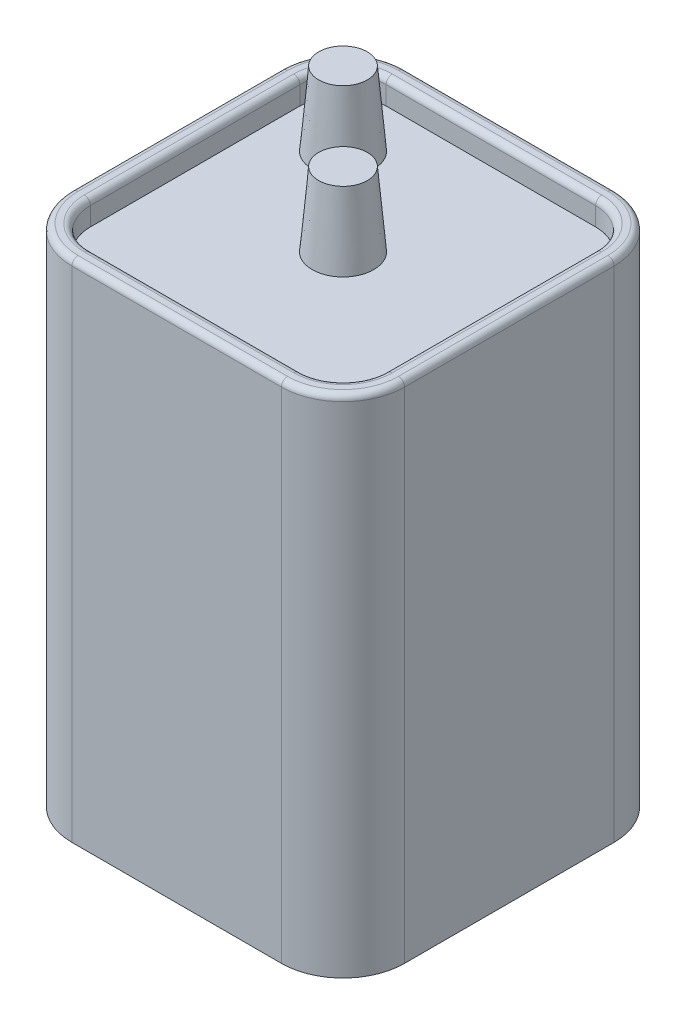
from build123d import *

# Parameters (mm, degrees)
SKETCH1_W                = 68.58
SKETCH1_H                = 68.58
BASE_EXTRUDE_DEPTH       = 104.14
SIDE_FILLET_R            = 12.7
TOP_CUT_DEPTH            = 5.08
FILLET_2_R               = 1.27
SKETCH_TERMINALS_R       = 6.35
TERMIALS_DEPTH           = 15.24
TERMIALS_DRAFT           = 5
TERMIALS_PROFILE_2_DEPTH = 15.24
TERMIALS_PROFILE_2_DRAFT = 5


with BuildPart() as part:
    # Sketch1 → Base Extrude (new body)
    with BuildSketch(Plane(origin=(0, 0, 0), x_dir=(1, 0, 0), z_dir=(0, 1, 0))):
        Rectangle(SKETCH1_W, SKETCH1_H)
    extrude(amount=BASE_EXTRUDE_DEPTH)

    # Side Fillet
    side_fillet_edges = [part.edges().sort_by_distance(p)[0] for p in [
        (34.29, 52.07, 34.29),
        (-34.29, 52.07, 34.29),
        (-34.29, 52.07, -34.29),
        (34.29, 52.07, -34.29),
    ]]
    fillet(side_fillet_edges, radius=SIDE_FILLET_R)

    # Sketch2 → Top Cut (cut)
    with BuildSketch(Plane(origin=(0, 104.14, 0), x_dir=(1, 0, 0), z_dir=(0, 1, 0))):
        with BuildLine():
            Line((-30.48, 21.59), (-30.48, -21.59))
            ThreePointArc((-30.48, -21.59), (-27.876179285, -27.876179285), (-21.59, -30.48))
            Line((-21.59, -30.48), (21.59, -30.48))
            ThreePointArc((21.59, -30.48), (27.876179285, -27.876179285), (30.48, -21.59))
            Line((30.48, -21.59), (30.48, 21.59))
            ThreePointArc((30.48, 21.59), (27.876179285, 27.876179285), (21.59, 30.48))
            Line((21.59, 30.48), (-21.59, 30.48))
            ThreePointArc((-21.59, 30.48), (-27.876179285, 27.876179285), (-30.48, 21.59))
        make_face()
    extrude(amount=-TOP_CUT_DEPTH, mode=Mode.SUBTRACT)

    # Fillet 2
    fillet_2_edges = [part.edges().sort_by_distance(p)[0] for p in [
        (0, 104.14, 34.29),
        (-34.29, 104.14, 0),
        (34.29, 104.14, 0),
        (0, 104.14, -34.29),
        (-30.570256121, 104.14, -30.570256121),
        (30.570256121, 104.14, -30.570256121),
        (30.570256121, 104.14, 30.570256121),
        (-30.570256121, 104.14, 30.570256121),
        (-27.876179285, 104.14, -27.876179285),
        (-30.48, 104.14, 0),
        (-27.876179285, 104.14, 27.876179285),
        (0, 104.14, 30.48),
        (27.876179285, 104.14, 27.876179285),
        (30.48, 104.14, 0),
        (27.876179285, 104.14, -27.876179285),
        (0, 104.14, -30.48),
    ]]
    fillet(fillet_2_edges, radius=FILLET_2_R)


with BuildPart() as termials_tool:
    # Sketch-TERMINALS → Termials (with draft: the straight prism first)
    with BuildSketch(Plane(origin=(0, 99.06, 0), x_dir=(1, 0, 0), z_dir=(0, 1, 0))):
        Circle(SKETCH_TERMINALS_R)
    extrude(amount=TERMIALS_DEPTH)
    # Termials: the draft: its side faces are tilted about the plane it starts from
    termials_sides = [termials_tool.faces().sort_by_distance(p)[0] for p in [
        (-6.35, 106.68, 0),
    ]]
    draft(termials_sides, Plane(origin=(0, 99.06, 0), x_dir=(1, 0, 0), z_dir=(0, 1, 0)), TERMIALS_DRAFT)


with BuildPart() as part_1:
    add(part.part)

    # Termials: add termials_tool
    add(termials_tool.part)


with BuildPart() as termials_profile_2_tool:
    # Sketch-TERMINALS → Termials profile 2 (with draft: the straight prism first)
    with BuildSketch(Plane(origin=(0, 99.06, 0), x_dir=(1, 0, 0), z_dir=(0, 1, 0))):
        with Locations((-17.960512242, 17.960512242)):
            Circle(SKETCH_TERMINALS_R)
    extrude(amount=TERMIALS_PROFILE_2_DEPTH)
    # Termials profile 2: the draft: its side faces are tilted about the plane it starts from
    termials_profile_2_sides = [termials_profile_2_tool.faces().sort_by_distance(p)[0] for p in [
        (-24.310512242, 106.68, -17.960512242),
    ]]
    draft(termials_profile_2_sides, Plane(origin=(0, 99.06, 0), x_dir=(1, 0, 0), z_dir=(0, 1, 0)), TERMIALS_PROFILE_2_DRAFT)


with BuildPart() as part_2:
    add(part_1.part)

    # Termials profile 2: add termials_profile_2_tool
    add(termials_profile_2_tool.part)


solid = part_2.part
